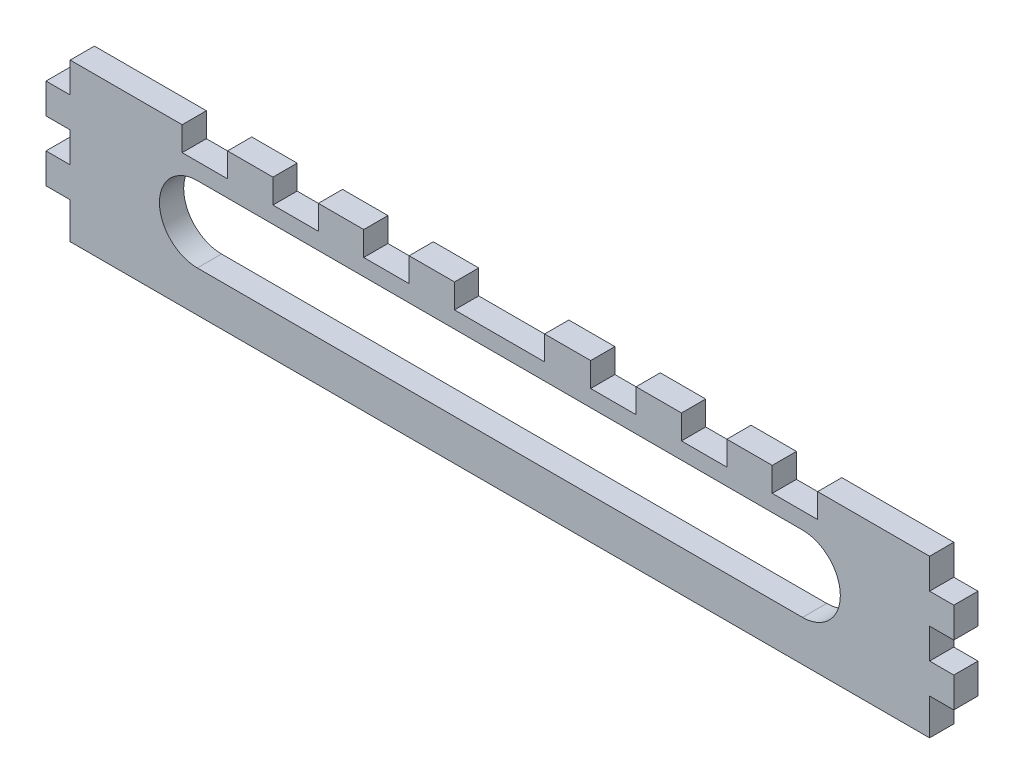
from build123d import *

# Parameters (mm, degrees)
ESQUISSE1_W             = 300
ESQUISSE1_H             = 52
BOSS_EXTRU_1_DEPTH      = 8
ESQUISSE2_W             = 8
ESQUISSE2_H             = 10
ENL_V_MAT_EXTRU_1_DEPTH = 153.446712001
ESQUISSE3_W             = 8
ESQUISSE3_H             = 2
ENL_V_MAT_EXTRU_2_DEPTH = 153.446712001
ENL_V_MAT_EXTRU_3_DEPTH = 153.446712001
ESQUISSE5_W             = 15
ESQUISSE5_H             = 8
ENL_V_MAT_EXTRU_4_DEPTH = 10


with BuildPart() as part:
    # Esquisse1 → Boss.-Extru.1 (new body)
    with BuildSketch(Plane.XY):
        Rectangle(ESQUISSE1_W, ESQUISSE1_H)
    extrude(amount=BOSS_EXTRU_1_DEPTH)

    # Esquisse2 → Enlèv. mat.-Extru.1 (cut, through all)
    with BuildSketch(Plane.XY):
        with Locations((-146, 1)):
            Rectangle(ESQUISSE2_W, ESQUISSE2_H)
        with Locations((-146, 21)):
            Rectangle(ESQUISSE2_W, ESQUISSE2_H)
        with Locations((-146, -19)):
            Rectangle(ESQUISSE2_W, ESQUISSE2_H)
    enl_v_mat_extru_1 = extrude(amount=ENL_V_MAT_EXTRU_1_DEPTH, mode=Mode.SUBTRACT)

    # Esquisse3 → Enlèv. mat.-Extru.2 (cut, through all)
    with BuildSketch(Plane.XY):
        with Locations((-146, -25)):
            Rectangle(ESQUISSE3_W, ESQUISSE3_H)
    enl_v_mat_extru_2 = extrude(amount=ENL_V_MAT_EXTRU_2_DEPTH, mode=Mode.SUBTRACT)

    # Symétrie1: Enlèv. mat.-Extru.1, Enlèv. mat.-Extru.2 across plane
    add(enl_v_mat_extru_1.mirror(Plane(origin=(0, 0, 0), x_dir=(0, 0, 1), z_dir=(1, 0, 0))), mode=Mode.SUBTRACT)
    add(enl_v_mat_extru_2.mirror(Plane(origin=(0, 0, 0), x_dir=(0, 0, 1), z_dir=(1, 0, 0))), mode=Mode.SUBTRACT)

    # Esquisse4 → Enlèv. mat.-Extru.3 (cut, through all)
    with BuildSketch(Plane.XY):
        with BuildLine():
            Line((-100, 12.5), (100, 12.5))
            ThreePointArc((100, 12.5), (112.5, 0), (100, -12.5))
            Line((100, -12.5), (-100, -12.5))
            ThreePointArc((-100, -12.5), (-112.5, 0), (-100, 12.5))
        make_face()
    extrude(amount=ENL_V_MAT_EXTRU_3_DEPTH, mode=Mode.SUBTRACT)

    # Esquisse5 → Enlèv. mat.-Extru.4 (cut)
    with BuildSketch(Plane.XY):
        Polygon((0, 26), (-15, 26), (-15, 18), (0, 18), (14.777360912, 18), (14.777360912, 26), align=None)
        with Locations((-37.5, 22)):
            Rectangle(ESQUISSE5_W, ESQUISSE5_H)
        with Locations((-67.5, 22)):
            Rectangle(ESQUISSE5_W, ESQUISSE5_H)
        with Locations((-97.5, 22)):
            Rectangle(ESQUISSE5_W, ESQUISSE5_H)
        with Locations((37.5, 22)):
            Rectangle(ESQUISSE5_W, ESQUISSE5_H)
        with Locations((67.5, 22)):
            Rectangle(ESQUISSE5_W, ESQUISSE5_H)
        with Locations((97.5, 22)):
            Rectangle(ESQUISSE5_W, ESQUISSE5_H)
    extrude(amount=ENL_V_MAT_EXTRU_4_DEPTH, mode=Mode.SUBTRACT)


solid = part.part
